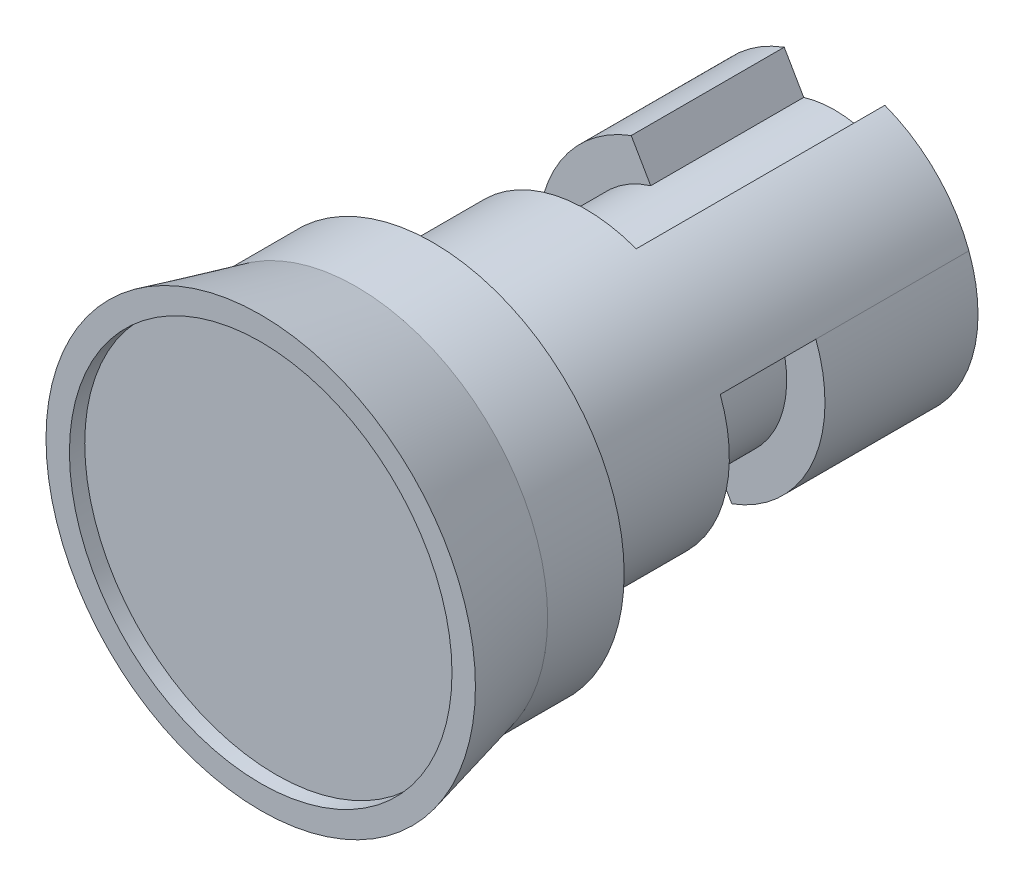
from build123d import *

# Parameters (mm, degrees)
SKETCH1_R           = 7.127875
BOSS_EXTRUDE1_DEPTH = 6.35
SKETCH2_R           = 4.7625
BOSS_EXTRUDE2_DEPTH = 12.7
SKETCH3_R           = 6.35
CUT_EXTRUDE1_DEPTH  = 0.508
CUT_EXTRUDE2_START  = -8.255
CUT_EXTRUDE2_DEPTH  = 8.255
CUT_EXTRUDE3_START  = -8.255
CUT_EXTRUDE3_DEPTH  = 3.175
CUT_EXTRUDE4_START  = -0.635
SKETCH7_R           = 6.35
SKETCH7_R_2         = 4.7625
CUT_EXTRUDE4_DEPTH  = 0.635


with BuildPart() as part:
    # Sketch1 → Boss-Extrude1 (new body)
    with BuildSketch(Plane.XY):
        Circle(SKETCH1_R)
    extrude(amount=BOSS_EXTRUDE1_DEPTH)

    # Sketch2 → Boss-Extrude2 (add)
    with BuildSketch(Plane(origin=(0, 0, 0), x_dir=(-1, 0, 0), z_dir=(0, 0, -1))):
        Circle(SKETCH2_R)
    extrude(amount=BOSS_EXTRUDE2_DEPTH)

    # Sketch3 → Cut-Extrude1 (cut)
    with BuildSketch(Plane.XY.offset(6.35)):
        Circle(SKETCH3_R)
    extrude(amount=-CUT_EXTRUDE1_DEPTH, mode=Mode.SUBTRACT)

    # Sketch4 → Cut-Extrude2 (cut)
    with BuildSketch(Plane(origin=(0, 0, -12.7), x_dir=(-1, 0, 0), z_dir=(0, 0, -1)).offset(CUT_EXTRUDE2_START)):
        with BuildLine():
            ThreePointArc((-1.023108387, 3.33928218), (0, 3.4925), (1.023108387, 3.33928218))
            Line((1.023108387, 3.33928218), (1.670175777, 4.460035776))
            ThreePointArc((1.670175777, 4.460035776), (0, 4.7625), (-1.670175777, 4.460035776))
            Line((-1.670175777, 4.460035776), (-1.023108387, 3.33928218))
        make_face()
        with BuildLine():
            Line((1.670175777, -4.460035776), (1.023108387, -3.33928218))
            ThreePointArc((1.023108387, -3.33928218), (0, -3.4925), (-1.023108387, -3.33928218))
            Line((-1.023108387, -3.33928218), (-1.670175777, -4.460035776))
            ThreePointArc((-1.670175777, -4.460035776), (0, -4.7625), (1.670175777, -4.460035776))
        make_face()
    extrude(amount=CUT_EXTRUDE2_DEPTH, mode=Mode.SUBTRACT)

    # Sketch5 → Cut-Extrude3 (cut)
    with BuildSketch(Plane(origin=(0, 0, -12.7), x_dir=(-1, 0, 0), z_dir=(0, 0, -1)).offset(CUT_EXTRUDE3_START)):
        with BuildLine():
            Line((1.670175777, 4.460035776), (1.023108387, 3.33928218))
            ThreePointArc((1.023108387, 3.33928218), (2.469570433, 2.469570433), (3.33928218, 1.023108387))
            ThreePointArc((3.33928218, 1.023108387), (3.453983155, 0.517258753), (3.4925, 0))
            ThreePointArc((3.4925, 0), (3.453983155, -0.517258753), (3.33928218, -1.023108387))
            Line((3.33928218, -1.023108387), (4.460035776, -1.670175777))
            ThreePointArc((4.460035776, -1.670175777), (4.686273927, -0.848671275), (4.7625, 0))
            ThreePointArc((4.7625, 0), (4.686273927, 0.848671275), (4.460035776, 1.670175777))
            ThreePointArc((4.460035776, 1.670175777), (3.367596045, 3.367596045), (1.670175777, 4.460035776))
        make_face()
        with BuildLine():
            ThreePointArc((1.670175777, 4.460035776), (0, 4.7625), (-1.670175777, 4.460035776))
            Line((-1.670175777, 4.460035776), (-1.023108387, 3.33928218))
            ThreePointArc((-1.023108387, 3.33928218), (0, 3.4925), (1.023108387, 3.33928218))
            Line((1.023108387, 3.33928218), (1.670175777, 4.460035776))
        make_face()
        with BuildLine():
            ThreePointArc((-1.670175777, -4.460035776), (0, -4.7625), (1.670175777, -4.460035776))
            Line((1.670175777, -4.460035776), (1.023108387, -3.33928218))
            ThreePointArc((1.023108387, -3.33928218), (0, -3.4925), (-1.023108387, -3.33928218))
            Line((-1.023108387, -3.33928218), (-1.670175777, -4.460035776))
        make_face()
        with BuildLine():
            ThreePointArc((-3.33928218, -1.023108387), (-3.4925, 0), (-3.33928218, 1.023108387))
            Line((-3.33928218, 1.023108387), (-4.460035776, 1.670175777))
            ThreePointArc((-4.460035776, 1.670175777), (-4.7625, 0), (-4.460035776, -1.670175777))
            ThreePointArc((-4.460035776, -1.670175777), (-3.367596045, -3.367596045), (-1.670175777, -4.460035776))
            Line((-1.670175777, -4.460035776), (-1.023108387, -3.33928218))
            ThreePointArc((-1.023108387, -3.33928218), (-2.469570433, -2.469570433), (-3.33928218, -1.023108387))
        make_face()
    extrude(amount=CUT_EXTRUDE3_DEPTH, mode=Mode.SUBTRACT)

    # Sketch6 → Cut-Revolve1 (revolve, cut)
    with BuildSketch(Plane(origin=(0, 0, 0), x_dir=(0, 0, -1), z_dir=(1, 0, 0)), mode=Mode.PRIVATE) as cut_revolve1_sk:
        Polygon((-6.35, 7.127875), (0, 7.127875), (0, 6.35), (-3.175, 6.35), align=None)
    revolve(cut_revolve1_sk.sketch.rotate(Axis((0, 0, -0.321507079), (0, 0, 1)), 290.529712626), axis=Axis((0, 0, -0.321507079), (0, 0, 1)), mode=Mode.SUBTRACT)

    # Sketch7 → Cut-Extrude4 (cut)
    with BuildSketch(Plane(origin=(0, 0, 0), x_dir=(-1, 0, 0), z_dir=(0, 0, -1)).offset(CUT_EXTRUDE4_START)):
        with Locations(Location((0, 0, 0), (0, 0, 90))):
            Circle(SKETCH7_R)
        with Locations(Location((0, 0, 0), (0, 0, 159.470287374))):
            Circle(SKETCH7_R_2, mode=Mode.SUBTRACT)
    extrude(amount=CUT_EXTRUDE4_DEPTH, mode=Mode.SUBTRACT)


solid = part.part
